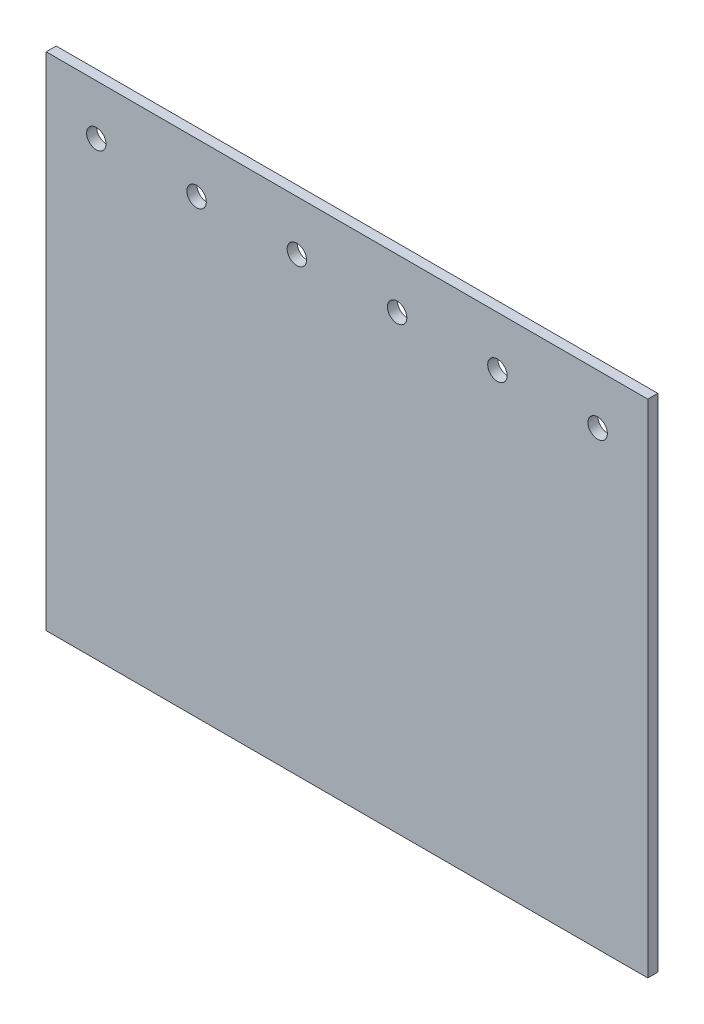
from build123d import *

# Parameters (mm, degrees)
SKETCH1_W                    = 152.4
SKETCH1_H                    = 127
BOSS_EXTRUDE1_DEPTH          = 2.54
F_10_0_1935_DIAMETER_HOLE1_D = 4.9149


with BuildPart() as part:
    # Sketch1 → Boss-Extrude1 (new body)
    with BuildSketch(Plane.XY):
        with Locations((-76.2, 63.5)):
            Rectangle(SKETCH1_W, SKETCH1_H)
    extrude(amount=BOSS_EXTRUDE1_DEPTH)

    # #10 (0.1935) Diameter Hole1 (through all)
    with Locations(Plane.XY.offset(2.54)):
        with Locations((-139.7, 114.3), (-114.3, 114.3), (-88.9, 114.3), (-63.5, 114.3), (-38.1, 114.3), (-12.7, 114.3)):
            Hole(F_10_0_1935_DIAMETER_HOLE1_D / 2)


solid = part.part
